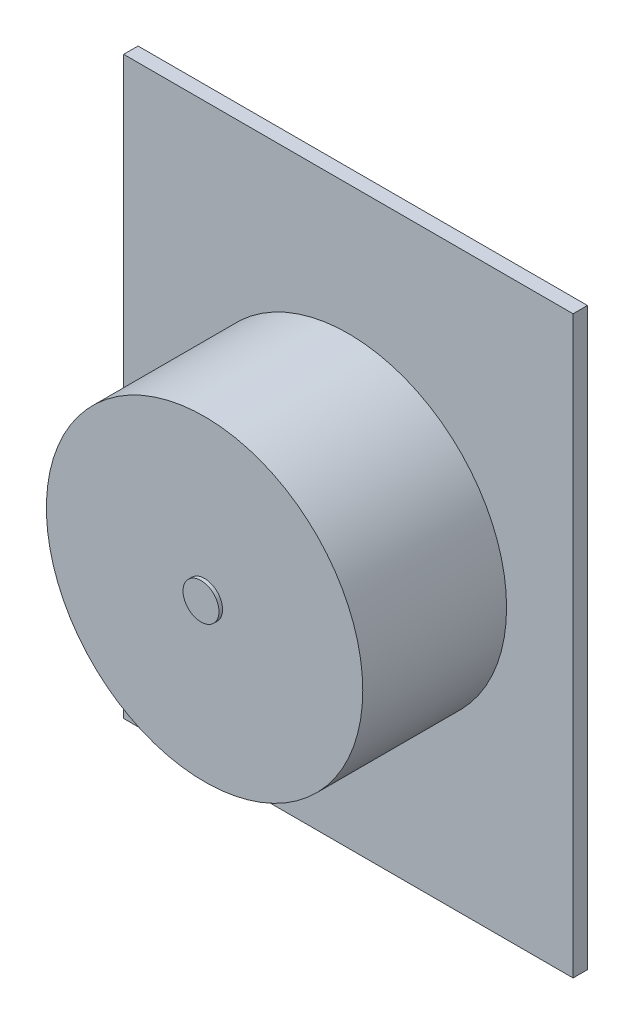
from build123d import *

# Parameters (mm, degrees)
ESQUISSE1_W        = 1250
ESQUISSE1_H        = 1600
BOSS_EXTRU_1_DEPTH = 40
ESQUISSE2_R        = 440
BOSS_EXTRU_2_DEPTH = 400
ESQUISSE3_R        = 50
BOSS_EXTRU_3_DEPTH = 10


with BuildPart() as part:
    # Esquisse1 → Boss.-Extru.1 (new body)
    with BuildSketch(Plane.XY):
        with Locations((-625, 800)):
            Rectangle(ESQUISSE1_W, ESQUISSE1_H)
    extrude(amount=BOSS_EXTRU_1_DEPTH)

    # Esquisse2 → Boss.-Extru.2 (add)
    with BuildSketch(Plane.XY.offset(40)):
        with Locations((-625, 800)):
            Circle(ESQUISSE2_R)
    extrude(amount=BOSS_EXTRU_2_DEPTH)

    # Esquisse3 → Boss.-Extru.3 (add)
    with BuildSketch(Plane.XY.offset(440)):
        with Locations((-625, 800)):
            Circle(ESQUISSE3_R)
    extrude(amount=BOSS_EXTRU_3_DEPTH)


solid = part.part
